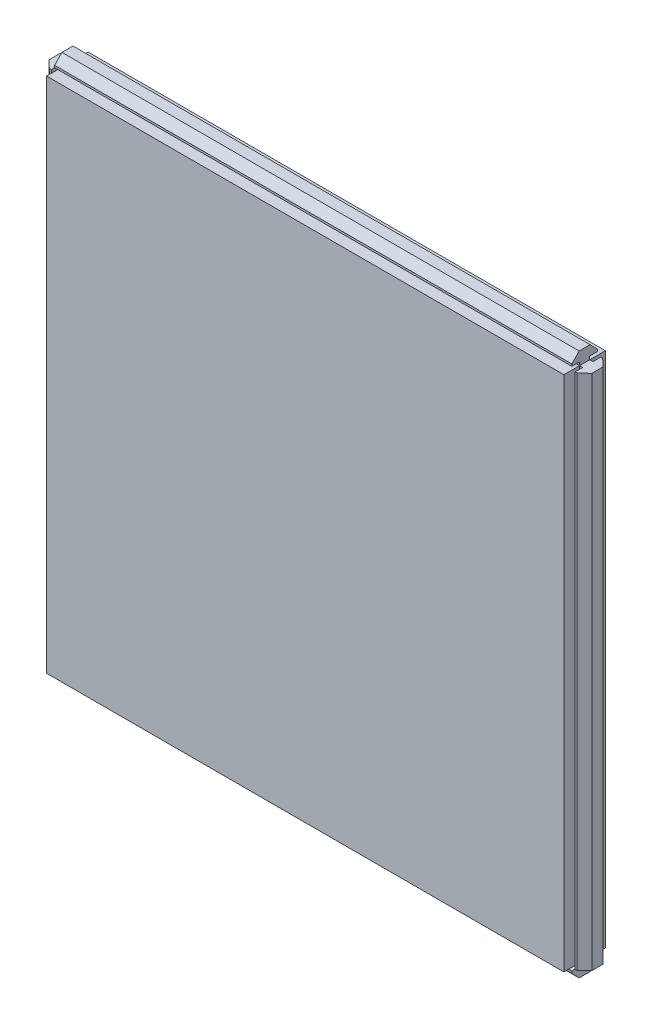
from build123d import *

# Parameters (mm, degrees)
BOSS_EXTRU_3_DEPTH            = 20
ENL_V_MAT_EXTRU_11_DEPTH      = 295.374154069
ENL_V_MAT_EXTRU_11_DEPTH_BACK = 249
ENL_V_MAT_EXTRU_12_DEPTH      = 295.374154069
ENL_V_MAT_EXTRU_12_DEPTH_BACK = 249
ENL_V_MAT_EXTRU_13_DEPTH      = 372.52143865
ENL_V_MAT_EXTRU_13_DEPTH_BACK = 249
ENL_V_MAT_EXTRU_14_DEPTH      = 372.52143865
ENL_V_MAT_EXTRU_14_DEPTH_BACK = 249
ENL_V_MAT_EXTRU_15_DEPTH      = 295.374154069
ENL_V_MAT_EXTRU_15_DEPTH_BACK = 249
ENL_V_MAT_EXTRU_16_DEPTH      = 295.374154069
ENL_V_MAT_EXTRU_16_DEPTH_BACK = 249
ENL_V_MAT_EXTRU_17_DEPTH      = 372.52143865
ENL_V_MAT_EXTRU_17_DEPTH_BACK = 249
ENL_V_MAT_EXTRU_18_DEPTH      = 372.52143865
ENL_V_MAT_EXTRU_18_DEPTH_BACK = 249


with BuildPart() as part:
    # Esquisse1 → Boss.-Extru.3 (new body)
    with BuildSketch(Plane.XY):
        Polygon((-263.060356118, 145.358531169), (-14.060356118, 145.358531169), (-14.060356118, 139.158531169), (-7.860356118, 139.158531169), (-7.860356118, -109.841468831), (-14.060356118, -109.841468831), (-14.060356118, -116.041468831), (-263.060356118, -116.041468831), (-263.060356118, -109.841468831), (-269.260356118, -109.841468831), (-269.260356118, 139.158531169), (-263.060356118, 139.158531169), align=None)
    extrude(amount=BOSS_EXTRU_3_DEPTH)

    # Esquisse4 → Enlèv. mat.-Extru.11 (cut, two sides: drawn at the far end of the back side and taken through both)
    with BuildSketch(Plane(origin=(-14.060356118, 0, 0), x_dir=(0, 0, -1), z_dir=(1, 0, 0)).offset(-ENL_V_MAT_EXTRU_11_DEPTH_BACK)):
        Polygon((-553.411816833, 139.158531169), (-20, 139.158531169), (-12.45, 139.158531169), (-12.45, 140.708531169), (-16.15, 140.708531169), (-16.15, 141.708531169), (-12.65, 145.358531169), (356.535030531, 530.365777294), (-64.826371106, 1510.451097334), (-974.77321847, 1119.243851209), align=None)
    extrude(amount=ENL_V_MAT_EXTRU_11_DEPTH + ENL_V_MAT_EXTRU_11_DEPTH_BACK, mode=Mode.SUBTRACT)

    # Esquisse8 → Enlèv. mat.-Extru.12 (cut, two sides: drawn at the far end of the back side and taken through both)
    with BuildSketch(Plane(origin=(-14.060356118, 0, 0), x_dir=(0, 0, -1), z_dir=(1, 0, 0)).offset(-ENL_V_MAT_EXTRU_12_DEPTH_BACK)):
        Polygon((533.411816833, 139.158531169), (0, 139.158531169), (-7.55, 139.158531169), (-7.55, 140.708531169), (-3.85, 140.708531169), (-3.85, 141.708531169), (-7.35, 145.358531169), (-376.535030531, 530.365777294), (44.826371106, 1510.451097334), (954.77321847, 1119.243851209), align=None)
    extrude(amount=ENL_V_MAT_EXTRU_12_DEPTH + ENL_V_MAT_EXTRU_12_DEPTH_BACK, mode=Mode.SUBTRACT)

    # Esquisse10 → Enlèv. mat.-Extru.13 (cut, two sides: drawn at the far end of the back side and taken through both)
    with BuildSketch(Plane(origin=(0, 139.158531169, 0), x_dir=(1, 0, 0), z_dir=(0, 1, 0)).offset(-ENL_V_MAT_EXTRU_13_DEPTH_BACK)):
        Polygon((-654.267602243, 356.535030531), (-269.260356118, -12.65), (-265.610356118, -16.15), (-264.610356118, -16.15), (-264.610356118, -12.45), (-263.060356118, -12.45), (-263.060356118, -20), (-263.060356118, -553.411816833), (-1243.145676157, -974.77321847), (-1634.352922282, -64.826371106), align=None)
    extrude(amount=ENL_V_MAT_EXTRU_13_DEPTH + ENL_V_MAT_EXTRU_13_DEPTH_BACK, mode=Mode.SUBTRACT)

    # Esquisse11 → Enlèv. mat.-Extru.14 (cut, two sides: drawn at the far end of the back side and taken through both)
    with BuildSketch(Plane(origin=(0, 139.158531169, 0), x_dir=(1, 0, 0), z_dir=(0, 1, 0)).offset(-ENL_V_MAT_EXTRU_14_DEPTH_BACK)):
        Polygon((-643.553156031, -387.393505759), (-269.260356118, -7.35), (-265.813317082, -3.85), (-264.610356118, -3.85), (-264.610356118, -7.55), (-263.060356118, -7.55), (-263.060356118, 0), (-263.060356118, 533.411816833), (-1249.023765439, 940.82907325), (-1629.516565352, 20.023750658), align=None)
    extrude(amount=ENL_V_MAT_EXTRU_14_DEPTH + ENL_V_MAT_EXTRU_14_DEPTH_BACK, mode=Mode.SUBTRACT)

    # Esquisse12 → Enlèv. mat.-Extru.15 (cut, two sides: drawn at the far end of the back side and taken through both)
    with BuildSketch(Plane.ZY.offset(263.060356118).offset(-ENL_V_MAT_EXTRU_15_DEPTH_BACK)):
        Polygon((-356.535030531, -501.048714956), (12.65, -116.041468831), (16.15, -112.391468831), (16.15, -111.391468831), (12.45, -111.391468831), (12.45, -109.841468831), (20, -109.841468831), (553.411816833, -109.841468831), (974.77321847, -1089.92678887), (64.826371106, -1481.134034995), align=None)
    extrude(amount=ENL_V_MAT_EXTRU_15_DEPTH + ENL_V_MAT_EXTRU_15_DEPTH_BACK, mode=Mode.SUBTRACT)

    # Esquisse13 → Enlèv. mat.-Extru.16 (cut, two sides: drawn at the far end of the back side and taken through both)
    with BuildSketch(Plane.ZY.offset(263.060356118).offset(-ENL_V_MAT_EXTRU_16_DEPTH_BACK)):
        Polygon((376.535030531, -501.048714956), (7.35, -116.041468831), (3.85, -112.391468831), (3.85, -111.391468831), (7.55, -111.391468831), (7.55, -109.841468831), (0, -109.841468831), (-533.411816833, -109.841468831), (-954.77321847, -1089.92678887), (-44.826371106, -1481.134034995), align=None)
    extrude(amount=ENL_V_MAT_EXTRU_16_DEPTH + ENL_V_MAT_EXTRU_16_DEPTH_BACK, mode=Mode.SUBTRACT)

    # Esquisse15 → Enlèv. mat.-Extru.17 (cut, two sides: drawn at the far end of the back side and taken through both)
    with BuildSketch(Plane(origin=(0, 139.158531169, 0), x_dir=(1, 0, 0), z_dir=(0, 1, 0)).offset(-ENL_V_MAT_EXTRU_17_DEPTH_BACK)):
        Polygon((377.146890007, -376.535030531), (-7.860356118, -7.35), (-11.510356118, -3.85), (-12.510356118, -3.85), (-12.510356118, -7.55), (-14.060356118, -7.55), (-14.060356118, 0), (-14.060356118, 533.411816833), (966.024963922, 954.77321847), (1357.232210047, 44.826371106), align=None)
    extrude(amount=ENL_V_MAT_EXTRU_17_DEPTH + ENL_V_MAT_EXTRU_17_DEPTH_BACK, mode=Mode.SUBTRACT)

    # Esquisse16 → Enlèv. mat.-Extru.18 (cut, two sides: drawn at the far end of the back side and taken through both)
    with BuildSketch(Plane(origin=(0, 139.158531169, 0), x_dir=(1, 0, 0), z_dir=(0, 1, 0)).offset(-ENL_V_MAT_EXTRU_18_DEPTH_BACK)):
        Polygon((377.146890007, 356.535030531), (-7.860356118, -12.65), (-11.510356118, -16.15), (-12.510356118, -16.15), (-12.510356118, -12.45), (-14.060356118, -12.45), (-14.060356118, -20), (-14.060356118, -553.411816833), (966.024963922, -974.77321847), (1357.232210047, -64.826371106), align=None)
    extrude(amount=ENL_V_MAT_EXTRU_18_DEPTH + ENL_V_MAT_EXTRU_18_DEPTH_BACK, mode=Mode.SUBTRACT)


solid = part.part
